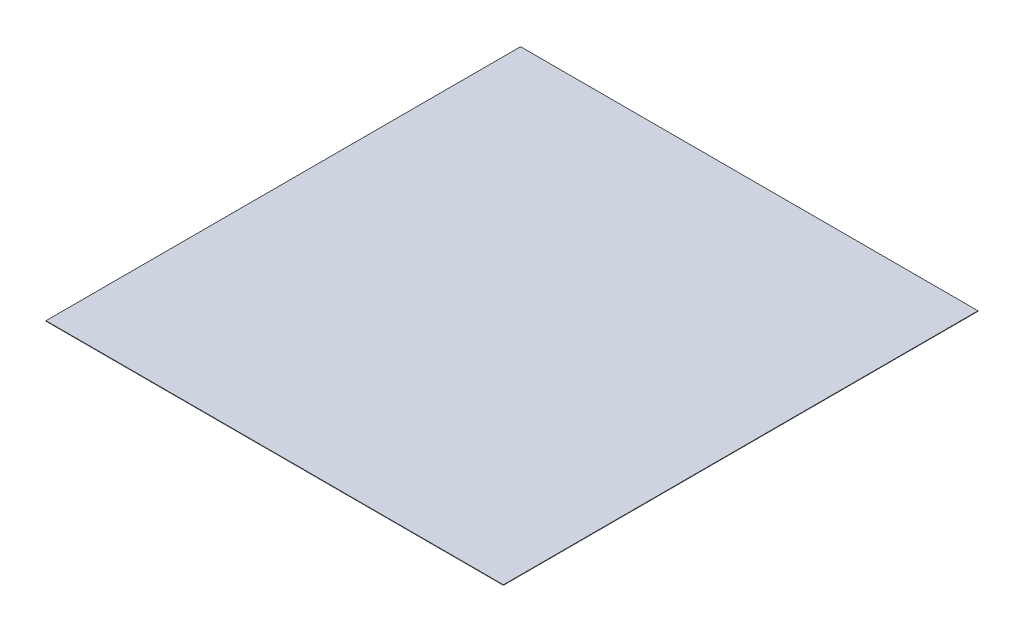
from build123d import *

# Parameters (mm, degrees)
SKETCH_1_W      = 1000
SKETCH_1_H      = 1037.5
EXTRUDE_1_DEPTH = 1


with BuildPart() as part:
    # Эскиз1 → Бобышка-Вытянуть1 (new body)
    with BuildSketch(Plane(origin=(0, 0, 0), x_dir=(1, 0, 0), z_dir=(0, 1, 0))):
        Rectangle(SKETCH_1_W, SKETCH_1_H)
    extrude(amount=EXTRUDE_1_DEPTH)


solid = part.part
